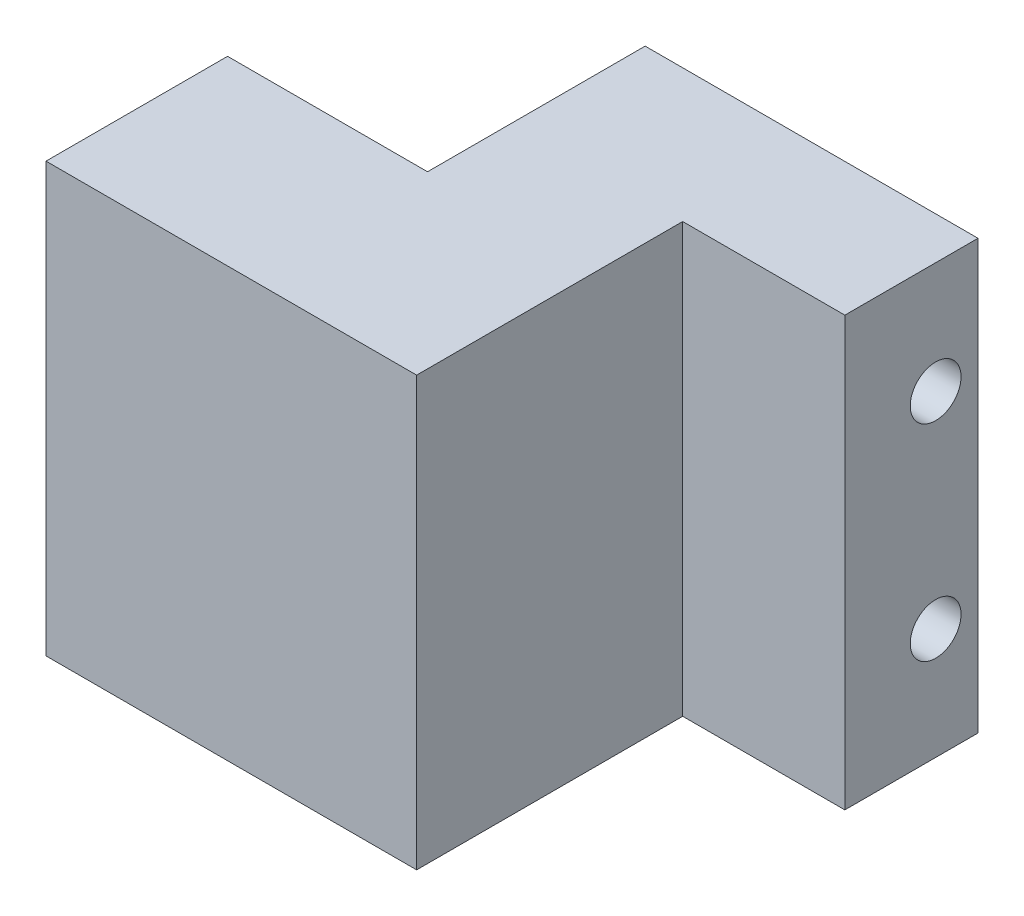
from build123d import *

# Parameters (mm, degrees)
BOSS_EXTRUDE1_DEPTH = 35.4
SKETCH2_W           = 8.63
SKETCH2_H           = 25.55
CUT_EXTRUDE1_DEPTH  = 30
SKETCH3_R           = 2.1
CUT_EXTRUDE2_DEPTH  = 64.958508207
CUT_EXTRUDE3_DEPTH  = 4.7625


with BuildPart() as part:
    # Sketch1 → Boss-Extrude1 (new body)
    with BuildSketch(Plane(origin=(0, 0, 0), x_dir=(1, 0, 0), z_dir=(0, 1, 0))):
        Polygon((1.0173917, 2.98), (-26.48, 2.98), (-26.48, -15), (-31.48, -15), (-43, -15), (-43, -30), (-12.38, -30), (-12.38, -8.02), (-11.48, -8.02), (1.0173917, -8.02), align=None)
    extrude(amount=BOSS_EXTRUDE1_DEPTH)

    # Sketch2 → Cut-Extrude1 (cut)
    with BuildSketch(Plane.ZY.offset(43)):
        with Locations((22.5, 17.7)):
            Rectangle(SKETCH2_W, SKETCH2_H)
    extrude(amount=-CUT_EXTRUDE1_DEPTH, mode=Mode.SUBTRACT)

    # Sketch3 → Cut-Extrude2 (cut, through all)
    with BuildSketch(Plane(origin=(1.0173917, 0, 0), x_dir=(0, 0, -1), z_dir=(1, 0, 0))):
        with Locations((-0.52, 9.2)):
            Circle(SKETCH3_R)
        with Locations((-0.52, 26.2)):
            Circle(SKETCH3_R)
    extrude(amount=-CUT_EXTRUDE2_DEPTH, mode=Mode.SUBTRACT)

    # Sketch4 → Cut-Extrude3 (cut)
    with BuildSketch(Plane.ZY.offset(26.48)):
        Polygon((-4.594313022, 9.2), (-2.037156511, 4.770875), (3.077156511, 4.770875), (5.634313022, 9.2), (3.077156511, 13.629125), (-2.037156511, 13.629125), align=None)
        Polygon((-4.594313022, 26.2), (-2.037156511, 21.770875), (3.077156511, 21.770875), (5.634313022, 26.2), (3.077156511, 30.629125), (-2.037156511, 30.629125), align=None)
    extrude(amount=-CUT_EXTRUDE3_DEPTH, mode=Mode.SUBTRACT)


solid = part.part
